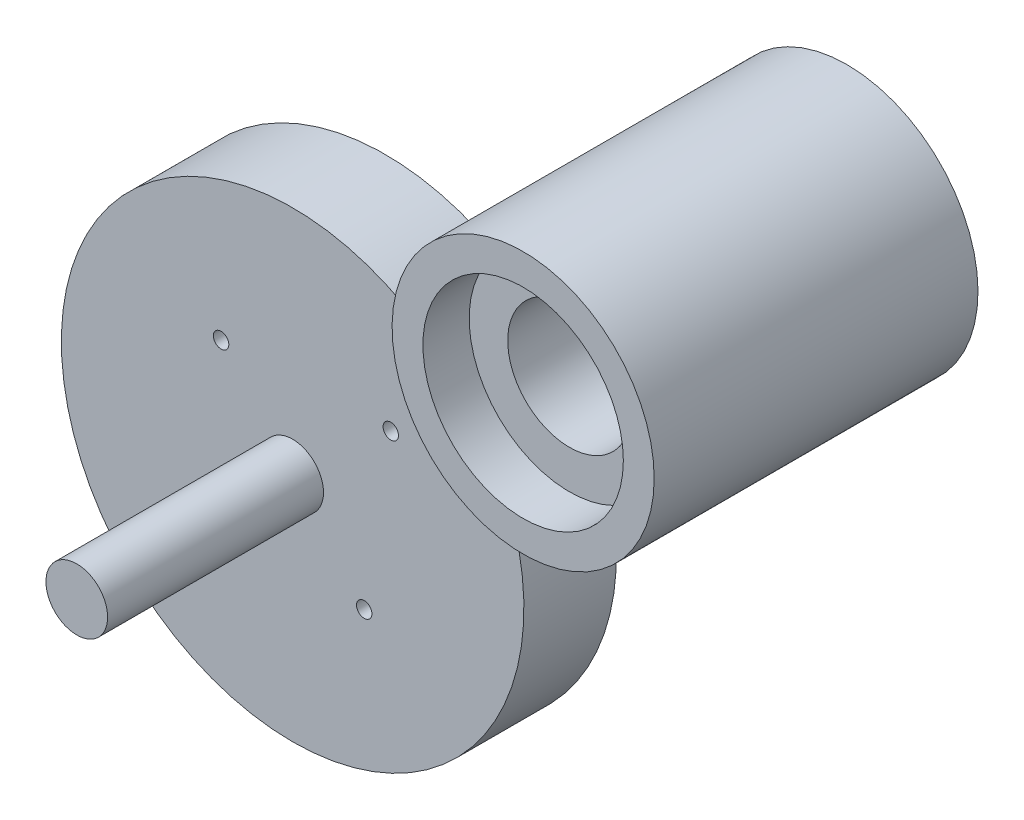
from build123d import *

# Parameters (mm, degrees)
SKETCH2_R            = 6.5
SKETCH2_R_2          = 0.5
SKETCH2_R_3          = 2
BOSS_EXTRUDE2_DEPTH  = 6
SKETCH2_14_R         = 2
BOSS_EXTRUDE9_DEPTH  = 20
BOSS_EXTRUDE5_START  = 6
SKETCH2_7_R          = 8.5
SKETCH2_7_R_2        = 6.5
BOSS_EXTRUDE5_DEPTH  = 15
BOSS_EXTRUDE10_START = 3
SKETCH2_16_R         = 6.5
SKETCH2_16_R_2       = 4
BOSS_EXTRUDE10_DEPTH = 15
RIB20_REACH          = 60.526
SKETCH6_WALL_W       = 131.852983596
SKETCH6_WALL_H       = 10


with BuildPart() as part:
    # Sketch2 → Boss-Extrude2 (new body)
    with BuildSketch(Plane.XY):
        with BuildLine():
            Line((10.269230614, 13.695123544), (24.482427586, 26.279928647))
            ThreePointArc((24.482427586, 26.279928647), (32.678156537, 40.21498183), (17.85326379, 33.766863091))
            Line((17.85326379, 33.766863091), (3.640066818, 21.182057988))
            ThreePointArc((3.640066818, 21.182057988), (-14.86387718, -1.880208276), (10.269230614, 13.695123544))
        make_face()
        with Locations((26.31426226, 34.580192603)):
            Circle(SKETCH2_R, mode=Mode.SUBTRACT)
        with Locations((2.730418762, 13.698326645)):
            Circle(SKETCH2_R_2, mode=Mode.SUBTRACT)
        with Locations((-9.997369792, 2.428748191)):
            Circle(SKETCH2_R_2, mode=Mode.SUBTRACT)
        with Locations((1.006939142, 2.822683307)):
            Circle(SKETCH2_R_2, mode=Mode.SUBTRACT)
        with Locations((-8.273890172, 13.304391529)):
            Circle(SKETCH2_R_2, mode=Mode.SUBTRACT)
        with Locations((-3.633475515, 8.063537418)):
            Circle(SKETCH2_R_3, mode=Mode.SUBTRACT)
    extrude(amount=BOSS_EXTRUDE2_DEPTH)

    # Sketch2<14> → Boss-Extrude9 (add)
    with BuildSketch(Plane.XY):
        with Locations((-3.633475515, 8.063537418)):
            Circle(SKETCH2_14_R)
    extrude(amount=BOSS_EXTRUDE9_DEPTH)

    # Sketch2<7> → Boss-Extrude5 (add)
    with BuildSketch(Plane.XY.offset(BOSS_EXTRUDE5_START)):
        with Locations(Location((26.31426226, 34.580192603, 0), (0, 0, 185.490794513))):
            Circle(SKETCH2_7_R)
        with Locations((26.31426226, 34.580192603)):
            Circle(SKETCH2_7_R_2, mode=Mode.SUBTRACT)
    extrude(amount=BOSS_EXTRUDE5_DEPTH)

    # Sketch2<16> → Boss-Extrude10 (add)
    with BuildSketch(Plane.XY.offset(BOSS_EXTRUDE10_START)):
        with Locations((26.31426226, 34.580192603)):
            Circle(SKETCH2_16_R)
        with Locations((26.31426226, 34.580192603)):
            Circle(SKETCH2_16_R_2, mode=Mode.SUBTRACT)
    extrude(amount=BOSS_EXTRUDE10_DEPTH)

    # Sketch6 wall → Rib20 (add, up to next)
    with BuildSketch(Plane(origin=(16.066946169, 25.506901345, 9.75), x_dir=(-0.606734584094, -0.537221605037, -0.585889146124), z_dir=(-0.438651362827, -0.388395511607, 0.810391207044)), mode=Mode.PRIVATE) as rib20_sk1:
        Rectangle(SKETCH6_WALL_W, SKETCH6_WALL_H)
    rib20_tool1 = extrude(rib20_sk1.sketch, amount=-RIB20_REACH, mode=Mode.PRIVATE) - part.part
    add(rib20_tool1.solids().sort_by_distance((16.066946169, 25.506901345, 9.75))[0])


solid = part.part
